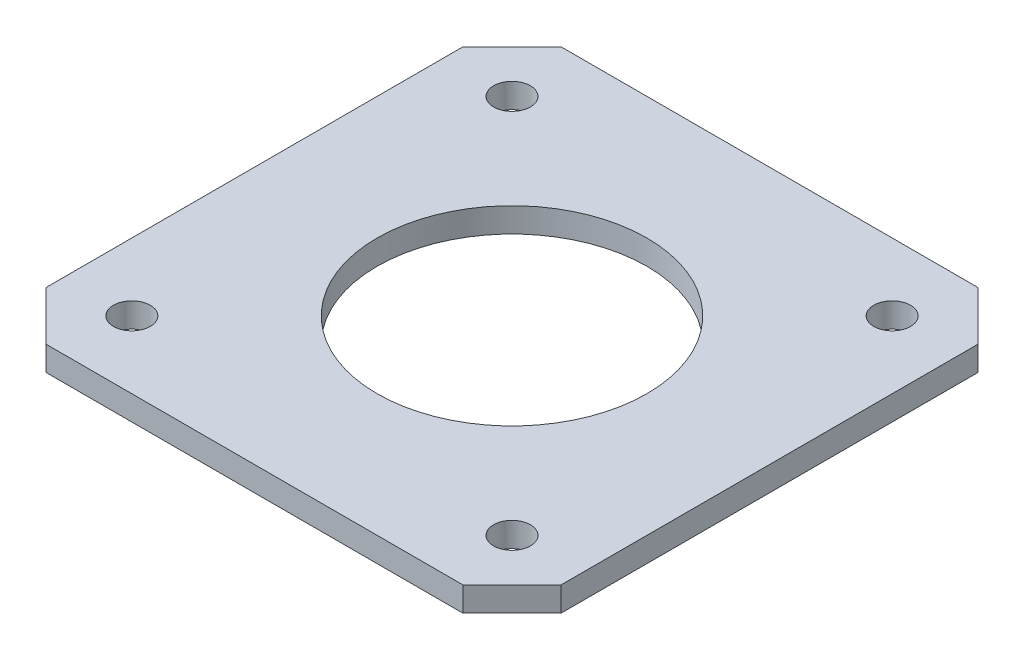
from build123d import *

# Parameters (mm, degrees)
SKETCH_1_R      = 11
SKETCH_1_R_2    = 1.5
EXTRUDE_1_DEPTH = 2


with BuildPart() as part:
    # 草图1 → 凸台-拉伸1 (new body)
    with BuildSketch(Plane(origin=(0, 9.963867234, 0), x_dir=(1, 0, 0), z_dir=(0, 1, 0))):
        Polygon((39.022489909, 61.148611754), (35.022489909, 57.148611754), (35.022489909, 23.148611754), (39.022489909, 19.148611754), (73.022489909, 19.148611754), (77.022489909, 23.148611754), (77.022489909, 57.148611754), (73.022489909, 61.148611754), align=None)
        with Locations(Location((56.022489909, 40.148611754, 0), (0, 0, 270))):
            Circle(SKETCH_1_R, mode=Mode.SUBTRACT)
        with Locations(Location((40.522489909, 24.648611754, 0), (0, 0, 270))):
            Circle(SKETCH_1_R_2, mode=Mode.SUBTRACT)
        with Locations(Location((71.522489909, 24.648611754, 0), (0, 0, 270))):
            Circle(SKETCH_1_R_2, mode=Mode.SUBTRACT)
        with Locations(Location((71.522489909, 55.648611754, 0), (0, 0, 270))):
            Circle(SKETCH_1_R_2, mode=Mode.SUBTRACT)
        with Locations(Location((40.522489909, 55.648611754, 0), (0, 0, 270))):
            Circle(SKETCH_1_R_2, mode=Mode.SUBTRACT)
    extrude(amount=EXTRUDE_1_DEPTH)


solid = part.part
